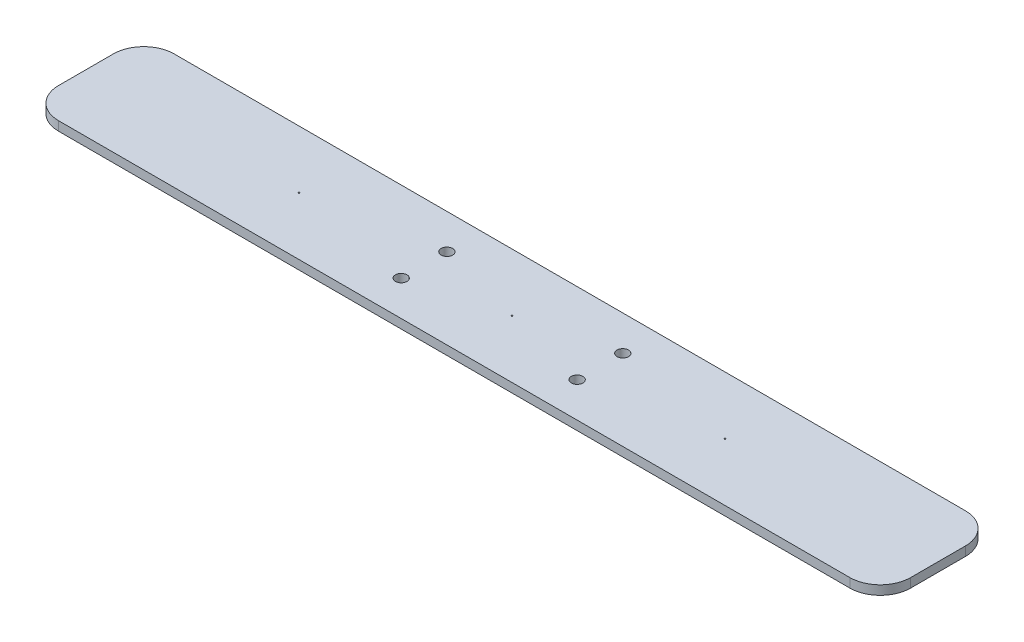
from build123d import *

# Parameters (mm, degrees)
BOSS_EXTRUDE1_DEPTH   = 3
F_6_CLEARANCE_HOLE1_D = 3.7973
SKETCH4_R             = 0.25
CUT_EXTRUDE1_DEPTH    = 10


with BuildPart() as part:
    # Sketch1 → Boss-Extrude1 (new body)
    with BuildSketch(Plane(origin=(0, 0, 0), x_dir=(1, 0, 0), z_dir=(0, 1, 0))):
        with BuildLine():
            Line((10, 0), (270, 0))
            ThreePointArc((270, 0), (277.071067812, -2.928932188), (280, -10))
            Line((280, -10), (280, -28))
            ThreePointArc((280, -28), (277.071067812, -35.071067812), (270, -38))
            Line((270, -38), (10, -38))
            ThreePointArc((10, -38), (2.928932188, -35.071067812), (0, -28))
            Line((0, -28), (0, -10))
            ThreePointArc((0, -10), (2.928932188, -2.928932188), (10, 0))
        make_face()
    extrude(amount=BOSS_EXTRUDE1_DEPTH)

    # #6 Clearance Hole1 (through all)
    with Locations(Plane(origin=(0, 3, 0), x_dir=(1, 0, 0), z_dir=(0, 1, 0))):
        with Locations((111.1, -11.5), (111.1, -26.5), (168.9, -26.5), (168.9, -11.5)):
            Hole(F_6_CLEARANCE_HOLE1_D / 2)

    # Sketch4 → Cut-Extrude1 (cut)
    with BuildSketch(Plane(origin=(0, 3, 0), x_dir=(1, 0, 0), z_dir=(0, 1, 0))):
        with Locations(Location((70, -19, 0), (0, 0, 270))):
            Circle(SKETCH4_R)
        with Locations(Location((140, -19, 0), (0, 0, 270))):
            Circle(SKETCH4_R)
        with Locations(Location((210, -19, 0), (0, 0, 270))):
            Circle(SKETCH4_R)
    extrude(amount=-CUT_EXTRUDE1_DEPTH, mode=Mode.SUBTRACT)


solid = part.part
